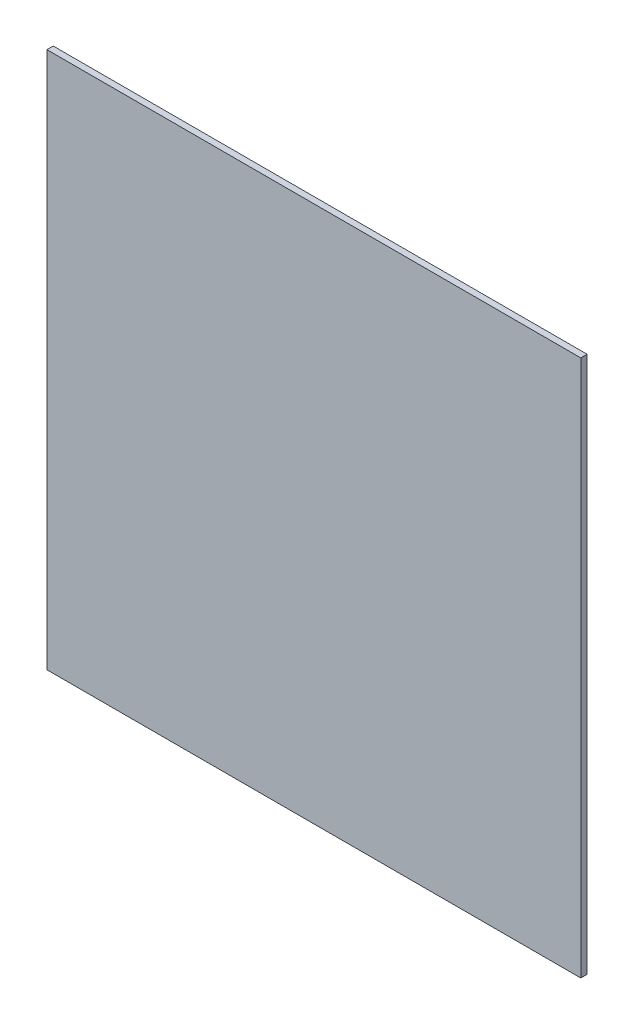
from build123d import *

# Parameters (mm, degrees)
MODEL_W             = 169
MODEL_H             = 170
BOSS_EXTRUDE1_DEPTH = 2


with BuildPart() as part:
    # Model → Boss-Extrude1 (new body)
    with BuildSketch(Plane.XY):
        Rectangle(MODEL_W, MODEL_H)
    extrude(amount=BOSS_EXTRUDE1_DEPTH)


solid = part.part
